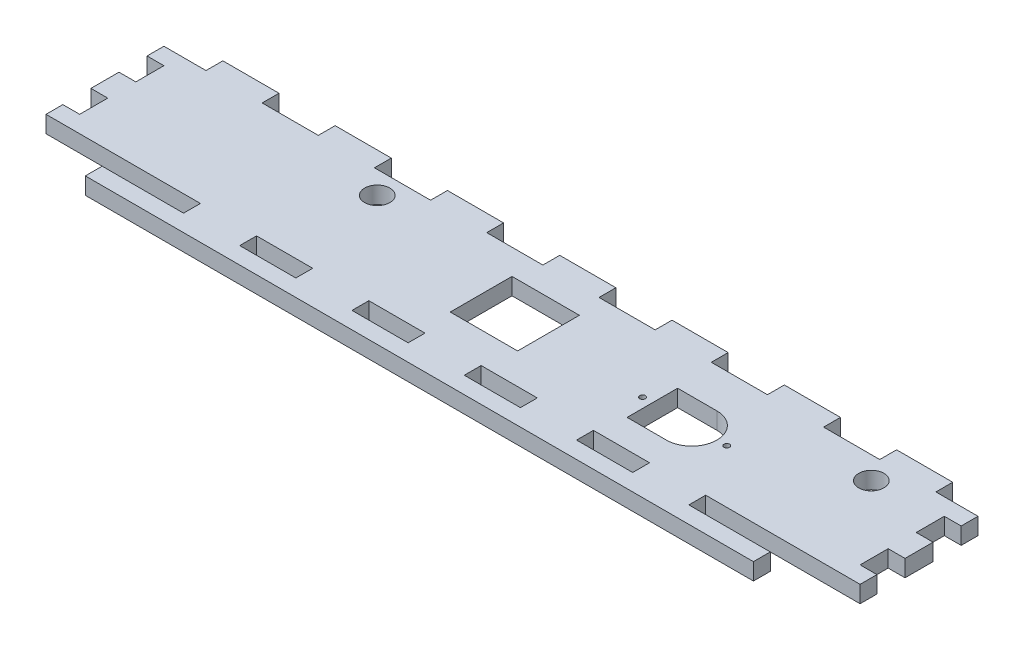
from build123d import *

# Parameters (mm, degrees)
SKETCH1_W           = 145
SKETCH1_H           = 21
BOSS_EXTRUDE1_DEPTH = 3
SKETCH2_W           = 12
SKETCH2_H           = 11
CUT_EXTRUDE1_DEPTH  = 147.543508898
SKETCH3_R           = 2.25
CUT_EXTRUDE2_DEPTH  = 147.543508898
SKETCH4_R           = 0.5
CUT_EXTRUDE3_DEPTH  = 147.543508898
SKETCH5_W           = 10
SKETCH5_H           = 3
BOSS_EXTRUDE2_DEPTH = 3
LPATTERN1_COUNT     = 4
LPATTERN1_PITCH     = 20
LPATTERN1_COL_COUNT = 4
LPATTERN1_COL_PITCH = 20
SKETCH6_W           = 145
SKETCH6_H           = 3
BOSS_EXTRUDE3_DEPTH = 3
SKETCH8_W           = 10
SKETCH8_H           = 3
CUT_EXTRUDE4_DEPTH  = 148.522879581
SKETCH9_W           = 3
SKETCH9_H           = 5
CUT_EXTRUDE5_DEPTH  = 148.522879581
SKETCH10_W          = 13
SKETCH10_H          = 3
CUT_EXTRUDE6_DEPTH  = 148.522879581


with BuildPart() as part:
    # Sketch1 → Boss-Extrude1 (new body)
    with BuildSketch(Plane(origin=(0, 0, 0), x_dir=(1, 0, 0), z_dir=(0, 1, 0))):
        with Locations((72.5, -10.5)):
            Rectangle(SKETCH1_W, SKETCH1_H)
    extrude(amount=BOSS_EXTRUDE1_DEPTH)

    # Sketch2 → Cut-Extrude1 (cut, through all)
    with BuildSketch(Plane(origin=(0, 3, 0), x_dir=(1, 0, 0), z_dir=(0, 1, 0))):
        with Locations((72.5, -10)):
            Rectangle(SKETCH2_W, SKETCH2_H)
    extrude(amount=-CUT_EXTRUDE1_DEPTH, mode=Mode.SUBTRACT)

    # Sketch3 → Cut-Extrude2 (cut, through all)
    with BuildSketch(Plane(origin=(0, 3, 0), x_dir=(1, 0, 0), z_dir=(0, 1, 0))):
        with Locations(Location((42, -4, 0), (0, 0, 270))):
            Circle(SKETCH3_R)
        with Locations(Location((130, -4, 0), (0, 0, 270))):
            Circle(SKETCH3_R)
    extrude(amount=-CUT_EXTRUDE2_DEPTH, mode=Mode.SUBTRACT)

    # Sketch4 → Cut-Extrude3 (cut, through all)
    with BuildSketch(Plane(origin=(0, 3, 0), x_dir=(1, 0, 0), z_dir=(0, 1, 0))):
        with BuildLine():
            Line((98.5, -7), (98.5, -16))
            Line((98.5, -16), (105.5, -16))
            ThreePointArc((105.5, -16), (110, -11.500000006), (105.500000011, -7))
            Line((105.500000011, -7), (98.5, -7))
        make_face()
        with Locations(Location((96.75, -11.5, 0), (0, 0, 270))):
            Circle(SKETCH4_R)
        with Locations(Location((111.75, -11.5, 0), (0, 0, 270))):
            Circle(SKETCH4_R)
    extrude(amount=-CUT_EXTRUDE3_DEPTH, mode=Mode.SUBTRACT)

    # Sketch5 → Boss-Extrude2 (add, through all)
    with BuildSketch(Plane(origin=(0, 3, 0), x_dir=(1, 0, 0), z_dir=(0, 1, 0))):
        with Locations((72.5, -22.5)):
            Rectangle(SKETCH5_W, SKETCH5_H)
        with Locations((72.5, 1.5)):
            Rectangle(SKETCH5_W, SKETCH5_H)
    boss_extrude2 = extrude(amount=-BOSS_EXTRUDE2_DEPTH)

    # LPattern1: Boss-Extrude2 ×4
    with Locations(*[(-i * LPATTERN1_PITCH, 0, 0) for i in range(1, LPATTERN1_COUNT)]):
        add(boss_extrude2)

    # LPattern1 col: Boss-Extrude2 ×4
    with Locations(*[(i * LPATTERN1_COL_PITCH, 0, 0) for i in range(1, LPATTERN1_COL_COUNT)]):
        add(boss_extrude2)

    # Sketch6 → Boss-Extrude3 (add, through all)
    with BuildSketch(Plane(origin=(0, 3, 0), x_dir=(1, 0, 0), z_dir=(0, 1, 0))):
        with Locations((72.5, -25.5)):
            Rectangle(SKETCH6_W, SKETCH6_H)
    extrude(amount=-BOSS_EXTRUDE3_DEPTH)

    # Sketch8 → Cut-Extrude4 (cut, through all)
    with BuildSketch(Plane(origin=(0, 0, 0), x_dir=(-1, 0, 0), z_dir=(0, -1, 0))):
        with Locations((-12.5, -22.5)):
            Rectangle(SKETCH8_W, SKETCH8_H)
        with Locations((-132.5, -22.5)):
            Rectangle(SKETCH8_W, SKETCH8_H)
    extrude(amount=-CUT_EXTRUDE4_DEPTH, mode=Mode.SUBTRACT)

    # Sketch9 → Cut-Extrude5 (cut, through all)
    with BuildSketch(Plane(origin=(0, 3, 0), x_dir=(1, 0, 0), z_dir=(0, 1, 0))):
        with Locations((1.5, -15.5)):
            Rectangle(SKETCH9_W, SKETCH9_H)
        with Locations((1.5, -5.5)):
            Rectangle(SKETCH9_W, SKETCH9_H)
        with Locations((143.5, -15.5)):
            Rectangle(SKETCH9_W, SKETCH9_H)
        with Locations((143.5, -5.5)):
            Rectangle(SKETCH9_W, SKETCH9_H)
    extrude(amount=-CUT_EXTRUDE5_DEPTH, mode=Mode.SUBTRACT)

    # Sketch10 → Cut-Extrude6 (cut, through all)
    with BuildSketch(Plane(origin=(0, 0, 0), x_dir=(-1, 0, 0), z_dir=(0, -1, 0))):
        with Locations((-6.5, -25.5)):
            Rectangle(SKETCH10_W, SKETCH10_H)
        with Locations((-138.5, -25.5)):
            Rectangle(SKETCH10_W, SKETCH10_H)
    extrude(amount=-CUT_EXTRUDE6_DEPTH, mode=Mode.SUBTRACT)


solid = part.part
